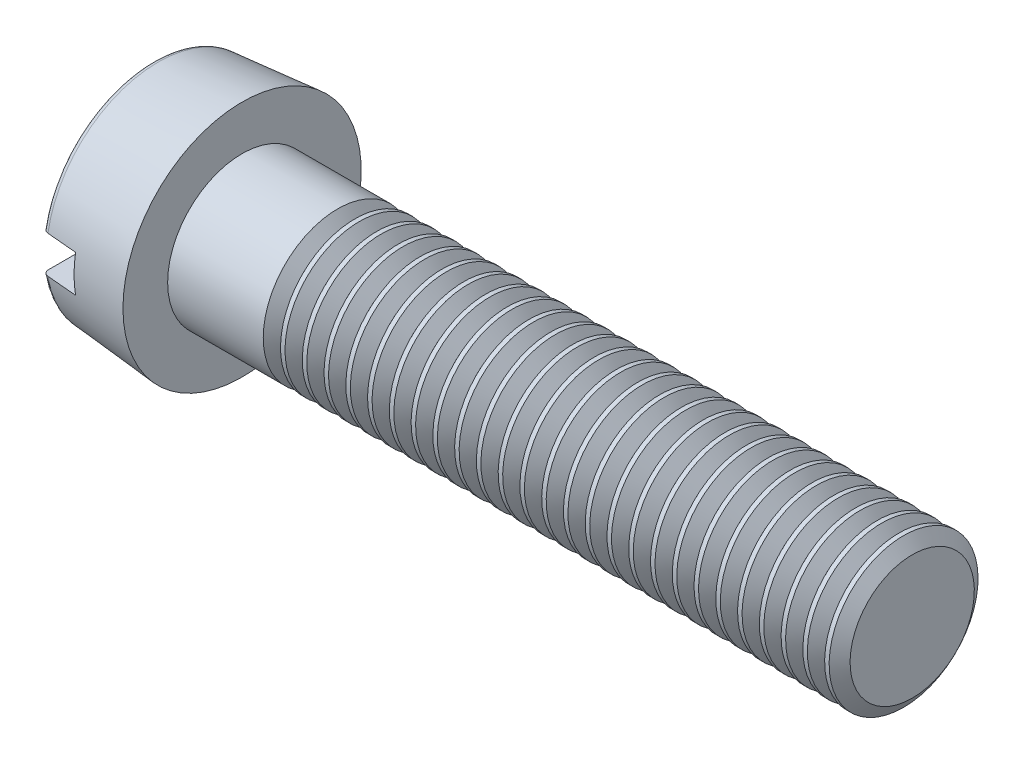
from build123d import *

# Parameters (mm, degrees)
FILLET2_R       = 0.4
SKETCH2_W       = 16
SKETCH2_H       = 2.5
SLOT_DEPTH      = 2.4
THDSCHPAT_COUNT = 27
THDSCHPAT_PITCH = 1.461538462


with BuildPart() as part:
    # BodySke → Base-Revolve (revolve)
    with BuildSketch(Plane.XY, mode=Mode.PRIVATE) as base_revolve_sk:
        Polygon((6, 5), (6, 8), (0, 7.475068019), (0, 0), (51, 0), (51, 5), align=None)
    revolve(base_revolve_sk.sketch.rotate(Axis((-25.4, 0, 0), (1, 0, 0)), 90), axis=Axis((-25.4, 0, 0), (1, 0, 0)))

    # Fillet2
    fillet2_edges = [part.edges().sort_by_distance(p)[0] for p in [
        (0, 0, -7.475068019),
    ]]
    fillet(fillet2_edges, radius=FILLET2_R)

    # Sketch2 → Slot (cut)
    with BuildSketch(Plane(origin=(0, 0, 0), x_dir=(0, 0, -1), z_dir=(1, 0, 0))):
        Rectangle(SKETCH2_W, SKETCH2_H)
    extrude(amount=SLOT_DEPTH, mode=Mode.SUBTRACT)

    # ThdSchSke → ThreadSchematic (revolve, cut)
    with BuildSketch(Plane.XY):
        Polygon((13, -4.172), (12.420228158, -5), (12.420228158, -6.25), (13.579771842, -6.25), (13.579771842, -5), align=None)
    threadschematic = revolve(axis=Axis((-3.175, 0, 0), (1, 0, 0)), mode=Mode.SUBTRACT)

    # ThdSchPat: ThreadSchematic ×27
    with Locations(*[(i * THDSCHPAT_PITCH, 0, 0) for i in range(1, THDSCHPAT_COUNT)]):
        add(threadschematic, mode=Mode.SUBTRACT)


solid = part.part
